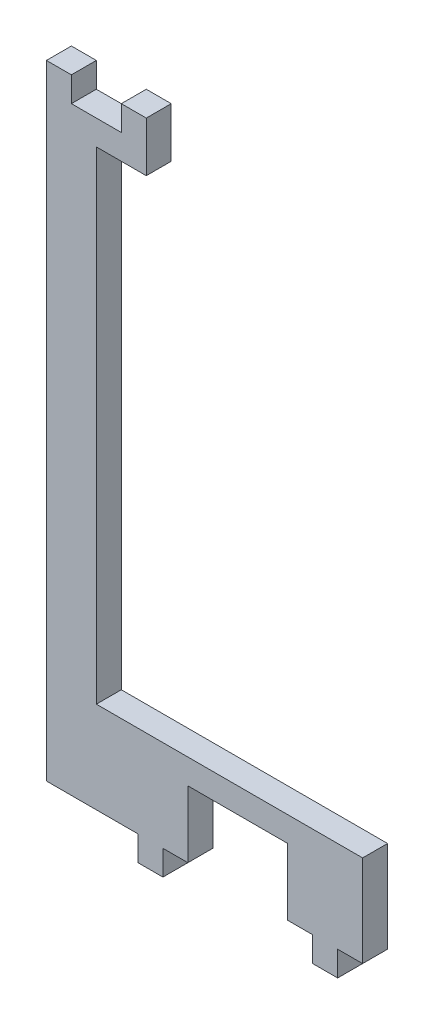
from build123d import *

# Parameters (mm, degrees)
SALIENTE_EXTRUIR1_DEPTH = 3


with BuildPart() as part:
    # Croquis1 → Saliente-Extruir1 (new body)
    with BuildSketch(Plane.XY):
        Polygon((17, -69), (17, -61), (5, -61), (5, -69), (2, -69), (2, -72), (-1, -72), (-1, -69), (-12, -69), (-12, 3), (-12, 6), (-9, 6), (-9, 3), (-3, 3), (-3, 6), (0, 6), (0, 0), (-6, 0), (-6, -58), (26, -58), (26, -69), (23, -69), (23, -72), (20, -72), (20, -69), align=None)
    extrude(amount=SALIENTE_EXTRUIR1_DEPTH)


solid = part.part
